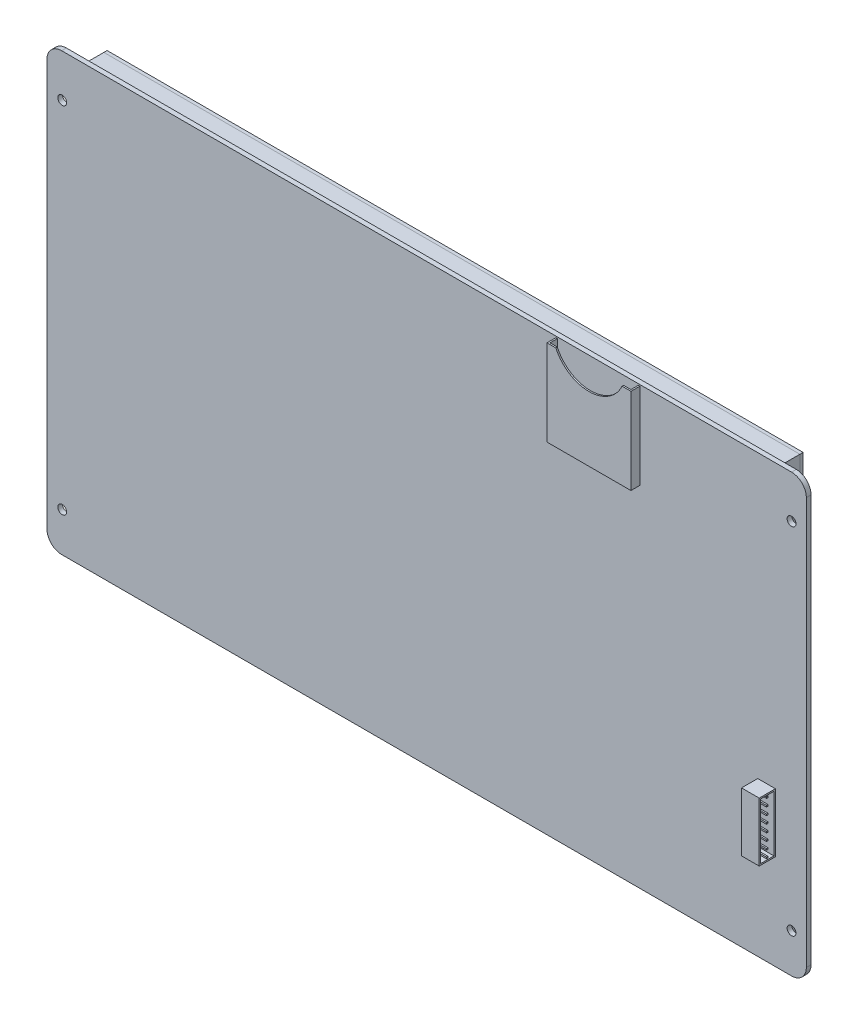
from build123d import *

# Parameters (mm, degrees)
SKETCH_1_W            = 257.9
SKETCH_1_H            = 148.2
EXTRUDE_1_DEPTH       = 1.6
FILLET_1_R            = 5
SKETCH_2_R            = 1.5
CUT_EXTRUDE_864_DEPTH = 1.6
SKETCH_3_W            = 236.4
SKETCH_3_H            = 144.4
EXTRUDE_1149_DEPTH    = 6.4
SKETCH_4_W            = 236.4
SKETCH_4_H            = 144.4
SKETCH_4_W_2          = 225.9
SKETCH_4_H_2          = 127.8
EXTRUDE_1442_DEPTH    = 0.5
SKETCH_5_W            = 222.7
SKETCH_5_H            = 125.3
EXTRUDE_1729_DEPTH    = 0.5
SKETCH_6_W            = 225.9
SKETCH_6_H            = 127.8
SKETCH_6_W_2          = 222.7
SKETCH_6_H_2          = 125.3
EXTRUDE_2020_DEPTH    = 0.4
SKETCH_7_W            = 6
SKETCH_7_H            = 20
EXTRUDE_4_DEPTH       = 5.5
SKETCH_8_W            = 4.5
SKETCH_8_H            = 19
CUT_EXTRUDE_1_DEPTH   = 5
SKETCH_9_W            = 0.5
SKETCH_9_H            = 0.5
EXTRUDE_5_DEPTH       = 5
EXTRUDE_6_DEPTH       = 3
SKETCH_11_W           = 27.5
SKETCH_11_H           = 2.5
CUT_EXTRUDE_2_DEPTH   = 25
SKETCH_14_W           = 236.4
SKETCH_14_H           = 144.4
SKETCH_14_W_2         = 225.9
SKETCH_14_H_2         = 127.8
EXTRUDE_4115_DEPTH    = 1.1


with BuildPart() as part:
    # 草图1 → 凸台-拉伸1 (new body)
    with BuildSketch(Plane.XY):
        Rectangle(SKETCH_1_W, SKETCH_1_H)
    extrude(amount=EXTRUDE_1_DEPTH)

    # 圆角1
    fillet_1_edges = [part.edges().sort_by_distance(p)[0] for p in [
        (-128.95, 74.1, 0.8),
        (128.95, 74.1, 0.8),
        (128.95, -74.1, 0.8),
        (-128.95, -74.1, 0.8),
    ]]
    fillet(fillet_1_edges, radius=FILLET_1_R)

    # 草图2 → Cut-Extrude 864 (cut)
    with BuildSketch(Plane.XY):
        with Locations((-123.77, 59.63)):
            Circle(SKETCH_2_R)
        with Locations(Location((123.93, 59.63, 0), (0, 0, 180))):
            Circle(SKETCH_2_R)
        with Locations((123.93, -60.77)):
            Circle(SKETCH_2_R)
        with Locations(Location((-123.77, -60.77, 0), (0, 0, 180))):
            Circle(SKETCH_2_R)
    extrude(amount=CUT_EXTRUDE_864_DEPTH, mode=Mode.SUBTRACT)

    # 草图3 → Extrude 1149 (add)
    with BuildSketch(Plane(origin=(0, 0, 0), x_dir=(-1, 0, 0), z_dir=(0, 0, -1))):
        with Locations((-0.07, 0.07)):
            Rectangle(SKETCH_3_W, SKETCH_3_H)
    extrude(amount=EXTRUDE_1149_DEPTH)

    # 草图4 → Extrude 1442 (add)
    with BuildSketch(Plane(origin=(0, 0, -6.4), x_dir=(-1, 0, 0), z_dir=(0, 0, -1))):
        with Locations((-0.07, 0.07)):
            Rectangle(SKETCH_4_W, SKETCH_4_H)
        with Locations((-1.08, -0.02)):
            Rectangle(SKETCH_4_W_2, SKETCH_4_H_2, mode=Mode.SUBTRACT)
    extrude(amount=EXTRUDE_1442_DEPTH)

    # 草图5 → Extrude 1729 (add)
    with BuildSketch(Plane(origin=(0, 0, -6.4), x_dir=(-1, 0, 0), z_dir=(0, 0, -1))):
        with Locations((-1.08, -0.02)):
            Rectangle(SKETCH_5_W, SKETCH_5_H)
    extrude(amount=EXTRUDE_1729_DEPTH)

    # 草图6 → Extrude 2020 (add)
    with BuildSketch(Plane(origin=(0, 0, -6.4), x_dir=(-1, 0, 0), z_dir=(0, 0, -1))):
        with Locations((-1.08, -0.02)):
            Rectangle(SKETCH_6_W, SKETCH_6_H)
        with Locations((-1.08, -0.02)):
            Rectangle(SKETCH_6_W_2, SKETCH_6_H_2, mode=Mode.SUBTRACT)
    extrude(amount=EXTRUDE_2020_DEPTH)

    # 草图7 → 凸台-拉伸4 (add)
    with BuildSketch(Plane.XY.offset(1.6)):
        with Locations((115.45, -31.77)):
            Rectangle(SKETCH_7_W, SKETCH_7_H)
    extrude(amount=EXTRUDE_4_DEPTH)

    # 草图8 → 切除-拉伸1 (cut)
    with BuildSketch(Plane(origin=(118.45, 0, 0), x_dir=(0, 0, -1), z_dir=(1, 0, 0))):
        with Locations((-4.35, -31.77)):
            Rectangle(SKETCH_8_W, SKETCH_8_H)
    extrude(amount=-CUT_EXTRUDE_1_DEPTH, mode=Mode.SUBTRACT)

    # 草图9 → 凸台-拉伸5 (add)
    with BuildSketch(Plane(origin=(113.45, 0, 0), x_dir=(0, 0, -1), z_dir=(1, 0, 0))):
        with Locations((-4.35, -30.5)):
            Rectangle(SKETCH_9_W, SKETCH_9_H)
        with Locations((-4.35, -27.96)):
            Rectangle(SKETCH_9_W, SKETCH_9_H)
        with Locations((-4.35, -25.42)):
            Rectangle(SKETCH_9_W, SKETCH_9_H)
        with Locations((-4.35, -22.88)):
            Rectangle(SKETCH_9_W, SKETCH_9_H)
        with Locations((-4.35, -40.66)):
            Rectangle(SKETCH_9_W, SKETCH_9_H)
        with Locations((-4.35, -38.12)):
            Rectangle(SKETCH_9_W, SKETCH_9_H)
        with Locations((-4.35, -35.58)):
            Rectangle(SKETCH_9_W, SKETCH_9_H)
        with Locations((-4.35, -33.04)):
            Rectangle(SKETCH_9_W, SKETCH_9_H)
    extrude(amount=EXTRUDE_5_DEPTH)

    # 草图10 → 凸台-拉伸6 (add)
    with BuildSketch(Plane.XY.offset(1.6)):
        with BuildLine():
            Line((46.88, 73.6), (43.88, 73.6))
            Line((43.88, 73.6), (43.88, 44.4))
            Line((43.88, 44.4), (72.38, 44.4))
            Line((72.38, 44.4), (72.38, 73.6))
            Line((72.38, 73.6), (69.38, 73.6))
            ThreePointArc((69.38, 73.6), (58.13, 66.4), (46.88, 73.6))
        make_face()
    extrude(amount=EXTRUDE_6_DEPTH)

    # 草图11 → 切除-拉伸2 (cut)
    with BuildSketch(Plane(origin=(0, 73.6, 0), x_dir=(1, 0, 0), z_dir=(0, 1, 0))):
        with Locations((58.13, -2.85)):
            Rectangle(SKETCH_11_W, SKETCH_11_H)
    extrude(amount=-CUT_EXTRUDE_2_DEPTH, mode=Mode.SUBTRACT)


with BuildPart() as body_2:
    # 草图14 → Extrude 4115 (new body)
    with BuildSketch(Plane(origin=(0, 0, -6.9), x_dir=(-1, 0, 0), z_dir=(0, 0, -1))):
        with Locations((-0.07, 0.07)):
            Rectangle(SKETCH_14_W, SKETCH_14_H)
        with Locations((-1.08, -0.02)):
            Rectangle(SKETCH_14_W_2, SKETCH_14_H_2, mode=Mode.SUBTRACT)
    extrude(amount=EXTRUDE_4115_DEPTH)


solid = Compound([part.part, body_2.part])
